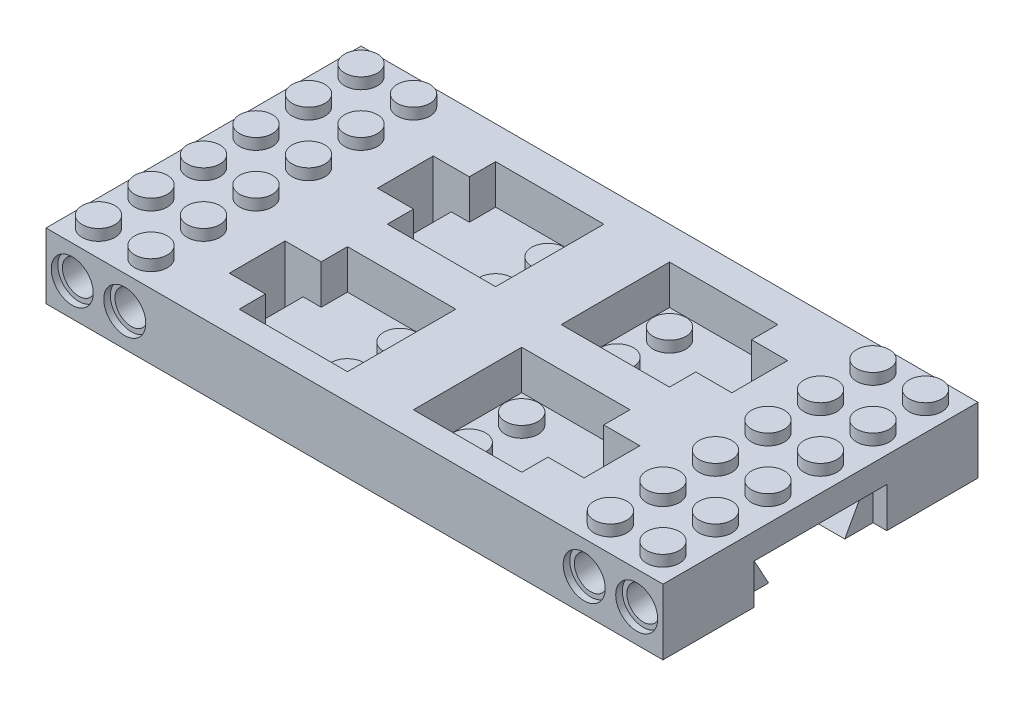
from build123d import *

# Parameters (mm, degrees)
SKETCH1_W           = 94
SKETCH1_H           = 48
BOSS_EXTRUDE1_DEPTH = 10
CUT_EXTRUDE1_DEPTH  = 6
SKETCH3_W           = 2.75
SKETCH3_H           = 8.5
CUT_EXTRUDE2_DEPTH  = 10
SKETCH4_R           = 2.5
BOSS_EXTRUDE2_DEPTH = 1.7
SKETCH5_R           = 2.5
BOSS_EXTRUDE3_DEPTH = 1.7
SKETCH6_R           = 2.5
CUT_EXTRUDE3_DEPTH  = 10
SKETCH11_R          = 3.2
CUT_EXTRUDE4_DEPTH  = 1
CUT_EXTRUDE5_START  = -10
SKETCH12_R          = 2.5
CUT_EXTRUDE5_DEPTH  = 10
CUT_EXTRUDE6_START  = -1
SKETCH13_R          = 3.2
CUT_EXTRUDE6_DEPTH  = 1
SKETCH15_W          = 20.2
SKETCH15_H          = 6.1
CUT_EXTRUDE7_DEPTH  = 2.1
CUT_EXTRUDE9_DEPTH  = 12
SKETCH19_W          = 11.1
SKETCH19_H          = 4.1
CUT_EXTRUDE10_DEPTH = 7.9
CUT_EXTRUDE11_DEPTH = 4.1


with BuildPart() as part:
    # Sketch1 → Boss-Extrude1 (new body)
    with BuildSketch(Plane(origin=(0, 0, 0), x_dir=(1, 0, 0), z_dir=(0, 1, 0))):
        Rectangle(SKETCH1_W, SKETCH1_H)
    extrude(amount=BOSS_EXTRUDE1_DEPTH)

    # Sketch2 → Cut-Extrude1 (cut)
    with BuildSketch(Plane(origin=(0, 10, 0), x_dir=(1, 0, 0), z_dir=(0, 1, 0))):
        Polygon((-21.568604419, -3.5), (-5.068604419, -3.5), (-5.068604419, -20), (-21.568604419, -20), (-21.568604419, -16), (-27.068604419, -16), (-27.068604419, -7.5), (-21.568604419, -7.5), align=None)
        Polygon((-21.5, 19), (-5, 19), (-5, 2.5), (-21.5, 2.5), (-21.5, 6.5), (-27, 6.5), (-27, 15), (-21.5, 15), align=None)
        Polygon((5, 19), (5, 2.5), (21.5, 2.5), (21.5, 6.5), (27, 6.5), (27, 15), (21.5, 15), (21.5, 19), align=None)
        Polygon((4.976902144, -3.5), (4.976902144, -20), (21.476902144, -20), (21.476902144, -16), (26.976902144, -16), (26.976902144, -7.5), (21.476902144, -7.5), (21.476902144, -3.5), align=None)
    extrude(amount=-CUT_EXTRUDE1_DEPTH, mode=Mode.SUBTRACT)

    # Sketch3 → Cut-Extrude2 (cut)
    with BuildSketch(Plane(origin=(0, 10, 0), x_dir=(1, 0, 0), z_dir=(0, 1, 0))):
        with Locations((25.625, 10.75)):
            Rectangle(SKETCH3_W, SKETCH3_H)
        with Locations((25.601902144, -11.75)):
            Rectangle(SKETCH3_W, SKETCH3_H)
        with Locations((-25.625, 10.75)):
            Rectangle(SKETCH3_W, SKETCH3_H)
        with Locations((-25.693604419, -11.75)):
            Rectangle(SKETCH3_W, SKETCH3_H)
    extrude(amount=-CUT_EXTRUDE2_DEPTH, mode=Mode.SUBTRACT)

    # Sketch4 → Boss-Extrude2 (add)
    with BuildSketch(Plane(origin=(0, 4, 0), x_dir=(1, 0, 0), z_dir=(0, 1, 0))):
        with Locations(Location((9.226902144, -7.75, 0), (0, 0, 270))):
            Circle(SKETCH4_R)
        with Locations(Location((9.226902144, -15.75, 0), (0, 0, 270))):
            Circle(SKETCH4_R)
        with Locations(Location((-9.318604419, -7.75, 0), (0, 0, 90))):
            Circle(SKETCH4_R)
        with Locations(Location((-9.318604419, -15.75, 0), (0, 0, 90))):
            Circle(SKETCH4_R)
        with Locations(Location((-9.25, 14.75, 0), (0, 0, 90))):
            Circle(SKETCH4_R)
        with Locations(Location((-9.25, 6.75, 0), (0, 0, 90))):
            Circle(SKETCH4_R)
        with Locations(Location((9.25, 14.75, 0), (0, 0, 270))):
            Circle(SKETCH4_R)
        with Locations(Location((9.25, 6.75, 0), (0, 0, 270))):
            Circle(SKETCH4_R)
    extrude(amount=BOSS_EXTRUDE2_DEPTH)

    # Sketch5 → Boss-Extrude3 (add)
    with BuildSketch(Plane(origin=(0, 10, 0), x_dir=(1, 0, 0), z_dir=(0, 1, 0))):
        with Locations(Location((-43, 20, 0), (0, 0, 270))):
            Circle(SKETCH5_R)
        with Locations(Location((-43, 12, 0), (0, 0, 270))):
            Circle(SKETCH5_R)
        with Locations(Location((-35, 20, 0), (0, 0, 270))):
            Circle(SKETCH5_R)
        with Locations(Location((-35, 12, 0), (0, 0, 270))):
            Circle(SKETCH5_R)
        with Locations(Location((-35, 4, 0), (0, 0, 270))):
            Circle(SKETCH5_R)
        with Locations(Location((-35, -4, 0), (0, 0, 270))):
            Circle(SKETCH5_R)
        with Locations(Location((-35, -12, 0), (0, 0, 270))):
            Circle(SKETCH5_R)
        with Locations(Location((-35, -20, 0), (0, 0, 270))):
            Circle(SKETCH5_R)
        with Locations(Location((-43, 4, 0), (0, 0, 270))):
            Circle(SKETCH5_R)
        with Locations(Location((-43, -4, 0), (0, 0, 270))):
            Circle(SKETCH5_R)
        with Locations(Location((-43, -12, 0), (0, 0, 270))):
            Circle(SKETCH5_R)
        with Locations(Location((-43, -20, 0), (0, 0, 270))):
            Circle(SKETCH5_R)
        with Locations(Location((43, -20, 0), (0, 0, 90))):
            Circle(SKETCH5_R)
        with Locations(Location((43, -12, 0), (0, 0, 90))):
            Circle(SKETCH5_R)
        with Locations(Location((43, -4, 0), (0, 0, 90))):
            Circle(SKETCH5_R)
        with Locations(Location((43, 4, 0), (0, 0, 90))):
            Circle(SKETCH5_R)
        with Locations(Location((35, -20, 0), (0, 0, 90))):
            Circle(SKETCH5_R)
        with Locations(Location((35, -12, 0), (0, 0, 90))):
            Circle(SKETCH5_R)
        with Locations(Location((35, -4, 0), (0, 0, 90))):
            Circle(SKETCH5_R)
        with Locations(Location((35, 4, 0), (0, 0, 90))):
            Circle(SKETCH5_R)
        with Locations(Location((35, 12, 0), (0, 0, 90))):
            Circle(SKETCH5_R)
        with Locations(Location((35, 20, 0), (0, 0, 90))):
            Circle(SKETCH5_R)
        with Locations(Location((43, 12, 0), (0, 0, 90))):
            Circle(SKETCH5_R)
        with Locations(Location((43, 20, 0), (0, 0, 90))):
            Circle(SKETCH5_R)
    extrude(amount=BOSS_EXTRUDE3_DEPTH)

    # Sketch6 → Cut-Extrude3 (cut)
    with BuildSketch(Plane.XY.offset(24)):
        with Locations((-43, 5)):
            Circle(SKETCH6_R)
        with Locations((-35, 5)):
            Circle(SKETCH6_R)
        with Locations(Location((35, 5, 0), (0, 0, 180))):
            Circle(SKETCH6_R)
        with Locations(Location((43, 5, 0), (0, 0, 180))):
            Circle(SKETCH6_R)
    extrude(amount=-CUT_EXTRUDE3_DEPTH, mode=Mode.SUBTRACT)

    # Sketch11 → Cut-Extrude4 (cut)
    with BuildSketch(Plane.XY.offset(24)):
        with Locations((-43, 5)):
            Circle(SKETCH11_R)
        with Locations((-35, 5)):
            Circle(SKETCH11_R)
        with Locations(Location((35, 5, 0), (0, 0, 180))):
            Circle(SKETCH11_R)
        with Locations(Location((43, 5, 0), (0, 0, 180))):
            Circle(SKETCH11_R)
    extrude(amount=-CUT_EXTRUDE4_DEPTH, mode=Mode.SUBTRACT)

    # Sketch12 → Cut-Extrude5 (cut)
    with BuildSketch(Plane(origin=(0, 0, -24), x_dir=(-1, 0, 0), z_dir=(0, 0, -1)).offset(CUT_EXTRUDE5_START)):
        with Locations((-43, 5)):
            Circle(SKETCH12_R)
        with Locations((-35, 5)):
            Circle(SKETCH12_R)
        with Locations(Location((35, 5, 0), (0, 0, 180))):
            Circle(SKETCH12_R)
        with Locations(Location((43, 5, 0), (0, 0, 180))):
            Circle(SKETCH12_R)
    extrude(amount=CUT_EXTRUDE5_DEPTH, mode=Mode.SUBTRACT)

    # Sketch13 → Cut-Extrude6 (cut)
    with BuildSketch(Plane(origin=(0, 0, -24), x_dir=(-1, 0, 0), z_dir=(0, 0, -1)).offset(CUT_EXTRUDE6_START)):
        with Locations((-43, 5)):
            Circle(SKETCH13_R)
        with Locations((-35, 5)):
            Circle(SKETCH13_R)
        with Locations(Location((35, 5, 0), (0, 0, 180))):
            Circle(SKETCH13_R)
        with Locations(Location((43, 5, 0), (0, 0, 180))):
            Circle(SKETCH13_R)
    extrude(amount=CUT_EXTRUDE6_DEPTH, mode=Mode.SUBTRACT)

    # Sketch15 → Cut-Extrude7 (cut)
    with BuildSketch(Plane(origin=(47, 0, 0), x_dir=(0, 0, -1), z_dir=(1, 0, 0))):
        with Locations((0, 3.05)):
            Rectangle(SKETCH15_W, SKETCH15_H)
    extrude(amount=-CUT_EXTRUDE7_DEPTH, mode=Mode.SUBTRACT)

    # Sketch17 → Cut-Extrude9 (cut)
    with BuildSketch(Plane.ZY.offset(47)):
        Polygon((-9.499804172, 0), (-12, 4.1), (-0.9, 4.1), (-3.399804172, 0), align=None)
        Polygon((0.9, 4.1), (3.399804172, 0), (9.499804172, 0), (12, 4.1), align=None)
    extrude(amount=-CUT_EXTRUDE9_DEPTH, mode=Mode.SUBTRACT)

    # Sketch19 → Cut-Extrude10 (cut)
    with BuildSketch(Plane.ZY.offset(35)):
        with Locations((-6.45, 2.05)):
            Rectangle(SKETCH19_W, SKETCH19_H)
        with Locations((6.45, 2.05)):
            Rectangle(SKETCH19_W, SKETCH19_H)
    extrude(amount=CUT_EXTRUDE10_DEPTH, mode=Mode.SUBTRACT)

    # Sketch16 → Cut-Extrude11 (cut)
    with BuildSketch(Plane(origin=(44.9, 0, 0), x_dir=(0, 0, -1), z_dir=(1, 0, 0))):
        Polygon((-5.8, 0), (-8.05, 4.1), (8.05, 4.1), (5.8, 0), align=None)
    extrude(amount=-CUT_EXTRUDE11_DEPTH, mode=Mode.SUBTRACT)


solid = part.part
